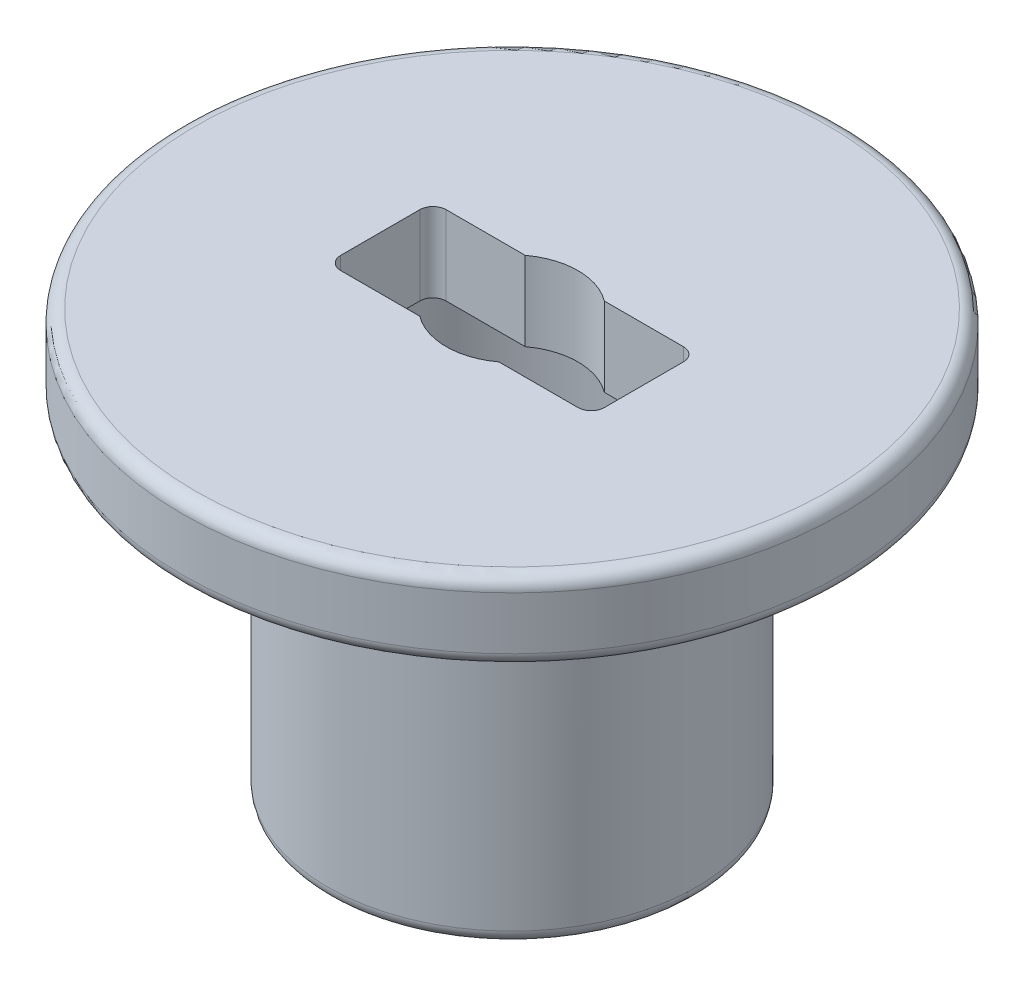
from build123d import *

# Parameters (mm, degrees)
SKETCH1_R           = 12.5
BOSS_EXTRUDE1_DEPTH = 3
SKETCH3_R           = 1
BOSS_EXTRUDE2_DEPTH = 3
SKETCH4_R           = 7
BOSS_EXTRUDE3_DEPTH = 13
CUT_EXTRUDE1_REACH  = 23.943
SKETCH5_R           = 6
FILLET2_R           = 0.5
FILLET3_R           = 0.5


with BuildPart() as part:
    # Sketch1 → Boss-Extrude1 (new body)
    with BuildSketch(Plane(origin=(0, 0, 0), x_dir=(1, 0, 0), z_dir=(0, 1, 0))):
        with Locations(Location((0, 0, 0), (0, 0, 270))):
            Circle(SKETCH1_R)
        with BuildLine():
            Line((1.5, 2), (4.5, 2))
            ThreePointArc((4.5, 2), (4.853553391, 1.853553391), (5, 1.5))
            Line((5, 1.5), (5, -1.5))
            ThreePointArc((5, -1.5), (4.853553391, -1.853553391), (4.5, -2))
            Line((4.5, -2), (1.5, -2))
            ThreePointArc((1.5, -2), (0, -2.5), (-1.5, -2))
            Line((-1.5, -2), (-4.5, -2))
            ThreePointArc((-4.5, -2), (-4.853553391, -1.853553391), (-5, -1.5))
            Line((-5, -1.5), (-5, 1.5))
            ThreePointArc((-5, 1.5), (-4.853553391, 1.853553391), (-4.5, 2))
            Line((-4.5, 2), (-1.5, 2))
            ThreePointArc((-1.5, 2), (0, 2.5), (1.5, 2))
        make_face(mode=Mode.SUBTRACT)
    extrude(amount=BOSS_EXTRUDE1_DEPTH)

    # Sketch3 → Boss-Extrude2 (add)
    with BuildSketch(Plane.XZ):
        with Locations(Location((-10.5, 0, 0), (0, 0, 90))):
            Circle(SKETCH3_R)
    extrude(amount=BOSS_EXTRUDE2_DEPTH)

    # Sketch4 → Boss-Extrude3 (add)
    with BuildSketch(Plane.XZ):
        with Locations(Location((0, 0, 0), (0, 0, 90))):
            Circle(SKETCH4_R)
    extrude(amount=BOSS_EXTRUDE3_DEPTH)

    # Sketch5 → Cut-Extrude1 (cut, up to next)
    with BuildSketch(Plane(origin=(0, 0, 0), x_dir=(1, 0, 0), z_dir=(0, 1, 0)), mode=Mode.PRIVATE) as cut_extrude1_sk1:
        with Locations(Location((0, 0, 0), (0, 0, 270))):
            Circle(SKETCH5_R)
    cut_extrude1_tool1 = extrude(cut_extrude1_sk1.sketch, amount=-CUT_EXTRUDE1_REACH, mode=Mode.PRIVATE) & part.part
    add(cut_extrude1_tool1.solids().sort_by_distance((0, 0, 0))[0], mode=Mode.SUBTRACT)

    # Fillet2
    fillet2_edges = [part.edges().sort_by_distance(p)[0] for p in [
        (0, 0, -12.5),
        (0, 3, -12.5),
    ]]
    fillet(fillet2_edges, radius=FILLET2_R)

    # Fillet3
    fillet3_edges = [part.edges().sort_by_distance(p)[0] for p in [
        (0, -13, -7),
    ]]
    fillet(fillet3_edges, radius=FILLET3_R)


solid = part.part
